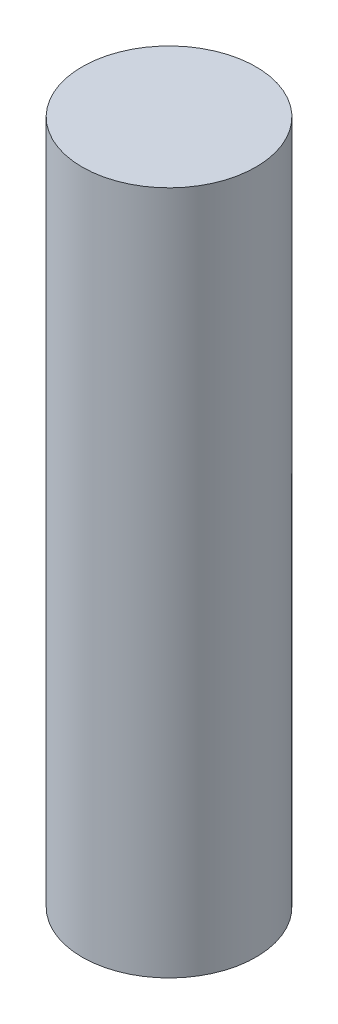
from build123d import *

# Parameters (mm, degrees)
SKETCH1_R           = 25.4
BOSS_EXTRUDE1_DEPTH = 200


with BuildPart() as part:
    # Sketch1 → Boss-Extrude1 (new body)
    with BuildSketch(Plane(origin=(0, 0, 0), x_dir=(1, 0, 0), z_dir=(0, 1, 0))):
        with Locations(Location((-72.831157328, 7.012528527, 0), (0, 0, 270))):
            Circle(SKETCH1_R)
    extrude(amount=BOSS_EXTRUDE1_DEPTH)


solid = part.part
